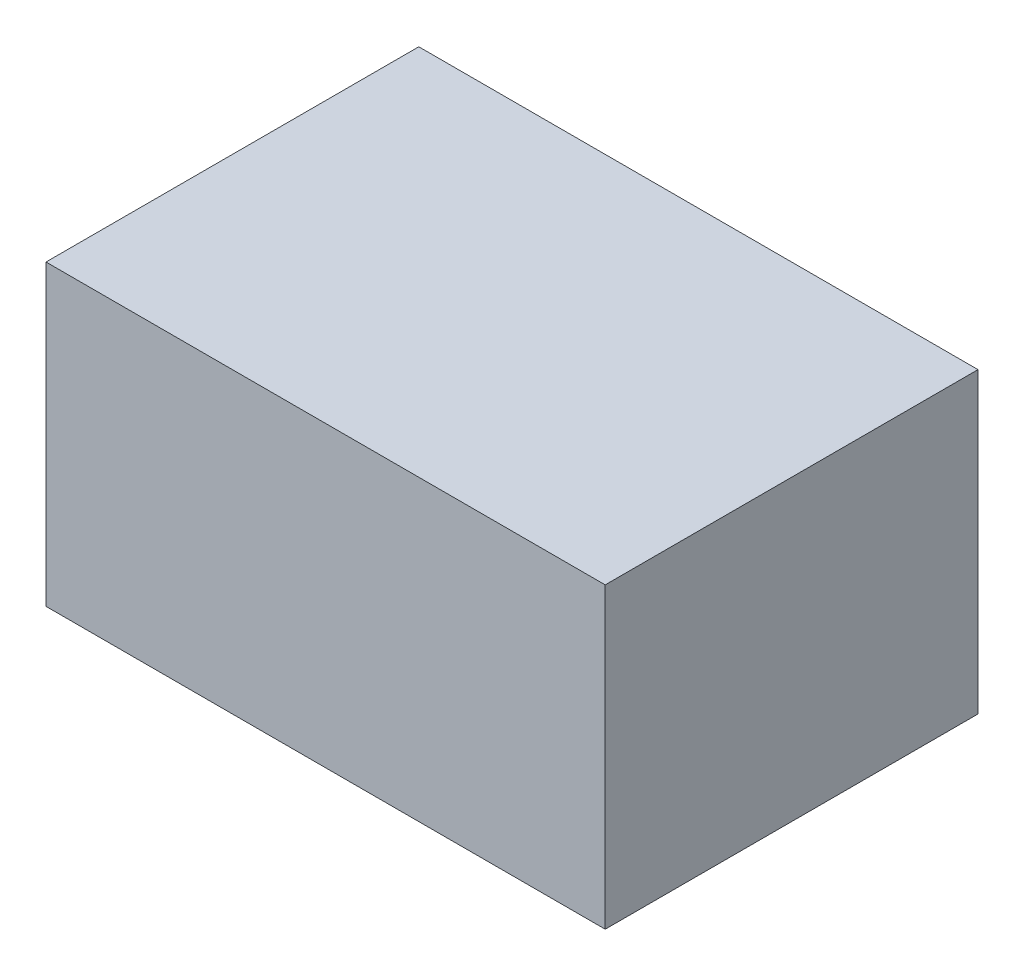
from build123d import *

# Parameters (mm, degrees)
SKETCH2_W           = 150
SKETCH2_H           = 80
BOSS_EXTRUDE1_DEPTH = 100


with BuildPart() as part:
    # Sketch2 → Boss-Extrude1 (new body)
    with BuildSketch(Plane.XY):
        Rectangle(SKETCH2_W, SKETCH2_H)
    extrude(amount=-BOSS_EXTRUDE1_DEPTH)


solid = part.part
